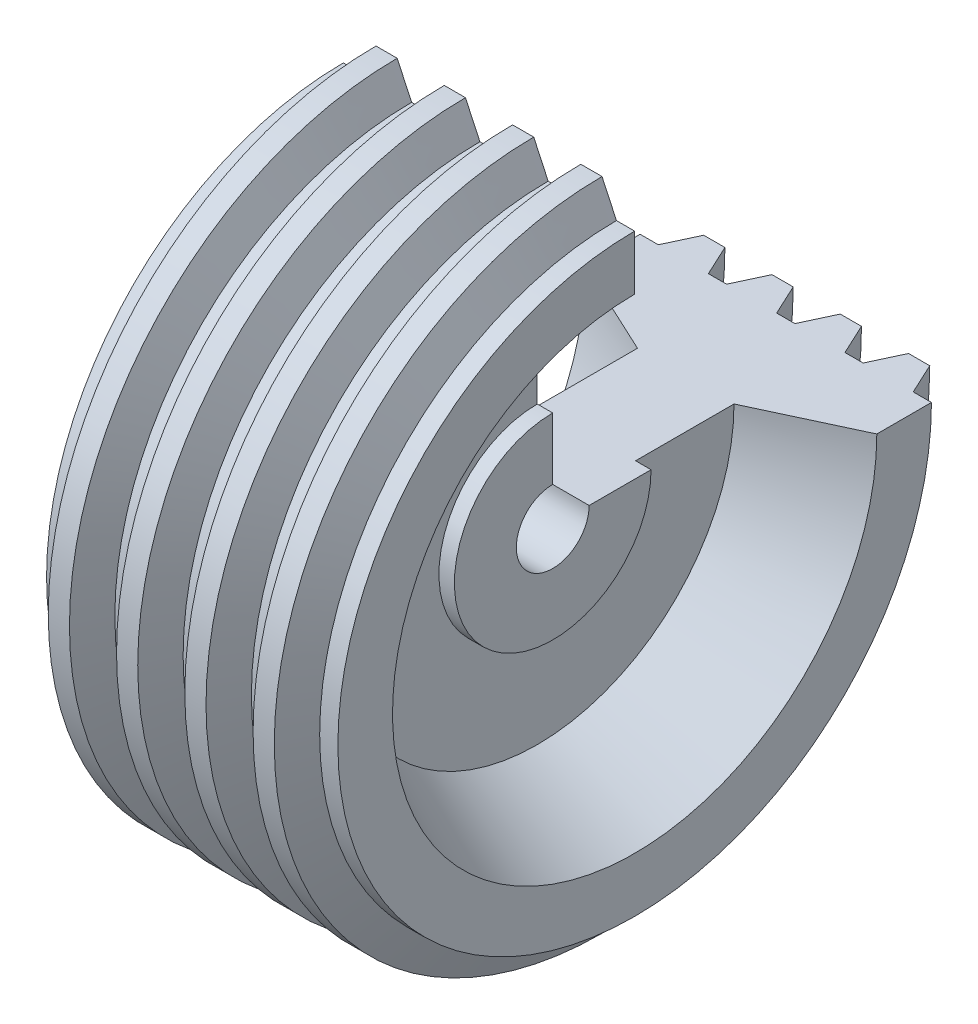
from build123d import *

# Parameters (mm, degrees)
REVOLVE1_ANGLE = 270


with BuildPart() as part:
    # Sketch2 → Revolve1 (revolve)
    with BuildSketch(Plane.XY):
        Polygon((35, 20), (-35, 20), (-35, 54), (-26.5, 54), (-26.5, 108.052540289), (-80, 133), (-80, 163), (-70, 163), (-62.072769811, 180), (-50.427230189, 180), (-42.5, 163), (-32.5, 163), (-24.572769811, 180), (-12.927230189, 180), (-5, 163), (5, 163), (12.927230189, 180), (24.572769811, 180), (32.5, 163), (42.5, 163), (50.427230189, 180), (62.072769811, 180), (70, 163), (80, 163), (80, 133), (26.5, 108.052540289), (26.5, 54), (35, 54), align=None)
    revolve(axis=Axis((0, 0, 0), (1, 0, 0)), revolution_arc=REVOLVE1_ANGLE)


solid = part.part
